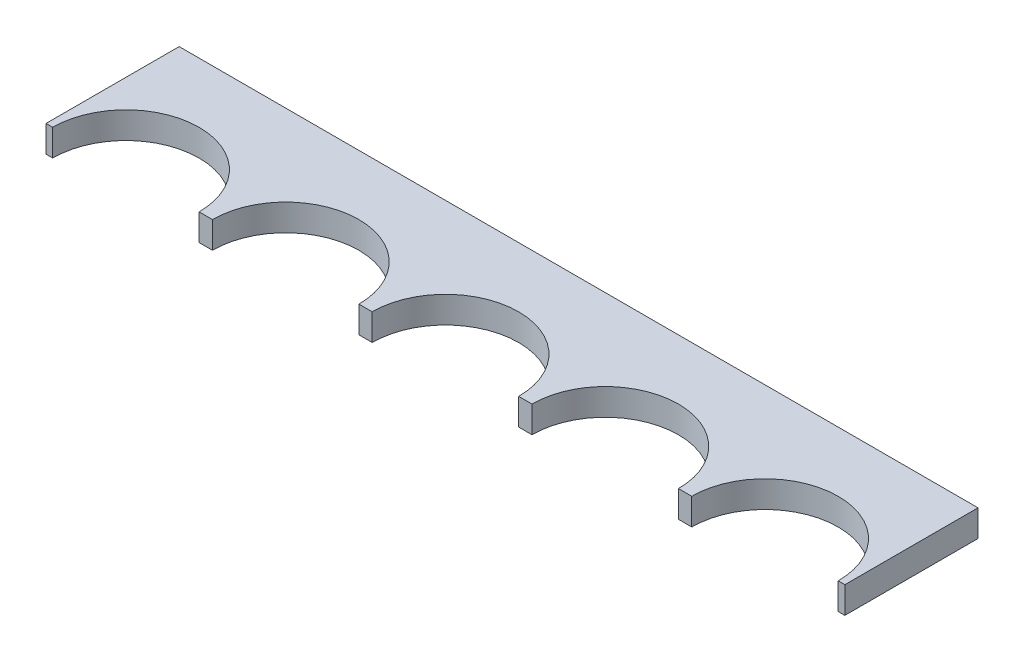
from build123d import *

# Parameters (mm, degrees)
BOSS_EXTRU_1_DEPTH = 10


with BuildPart() as part:
    # Esquisse1 → Boss.-Extru.1 (new body)
    with BuildSketch(Plane(origin=(0, 0, 0), x_dir=(1, 0, 0), z_dir=(0, 1, 0))):
        with BuildLine():
            Line((147.5, -25), (150, -25))
            Line((150, -25), (150, 25))
            Line((150, 25), (-150, 25))
            Line((-150, 25), (-150, -25))
            Line((-150, -25), (-147.5, -25))
            ThreePointArc((-147.5, -25), (-120, 2.5), (-92.5, -25))
            Line((-92.5, -25), (-87.5, -25))
            ThreePointArc((-87.5, -25), (-60, 2.5), (-32.5, -25))
            Line((-32.5, -25), (-27.5, -25))
            ThreePointArc((-27.5, -25), (0, 2.5), (27.5, -25))
            Line((27.5, -25), (32.5, -25))
            ThreePointArc((32.5, -25), (60, 2.5), (87.5, -25))
            Line((87.5, -25), (92.5, -25))
            ThreePointArc((92.5, -25), (120, 2.5), (147.5, -25))
        make_face()
    extrude(amount=BOSS_EXTRU_1_DEPTH)


solid = part.part
